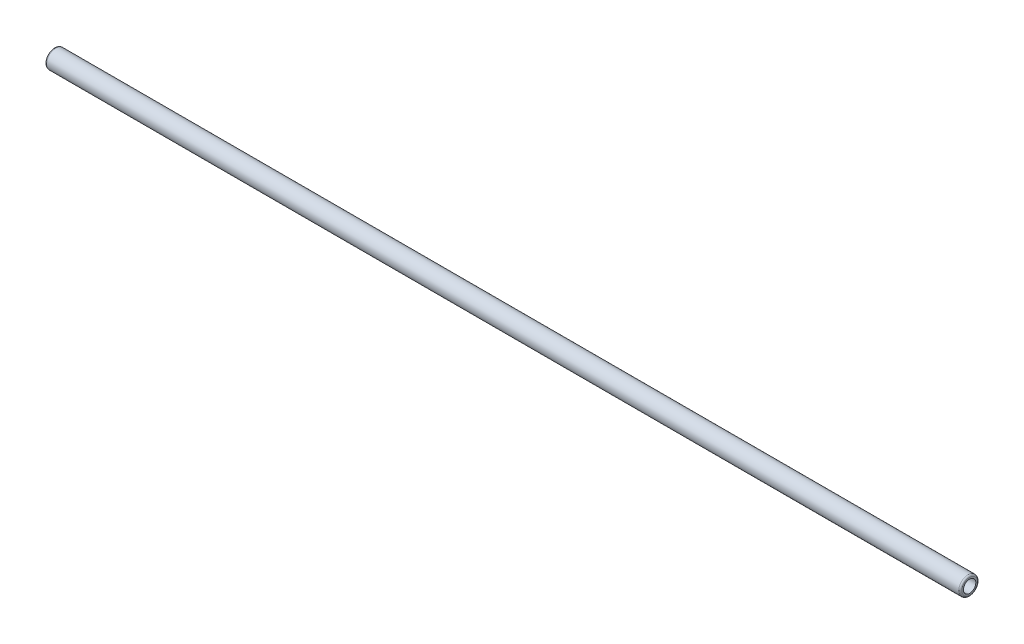
from build123d import *

# Parameters (mm, degrees)
SKETCH_1_R      = 3
SKETCH_1_R_2    = 2
EXTRUDE_1_DEPTH = 148
FILLET_1_R      = 0.5


with BuildPart() as part:
    # Эскиз1 → Бобышка-Вытянуть1 (new, symmetric)
    with BuildSketch(Plane(origin=(0, 0, 0), x_dir=(0, 0, -1), z_dir=(1, 0, 0))):
        Circle(SKETCH_1_R)
        Circle(SKETCH_1_R_2, mode=Mode.SUBTRACT)
    extrude(amount=EXTRUDE_1_DEPTH, both=True)

    # Скругление1
    fillet_1_edges = [part.edges().sort_by_distance(p)[0] for p in [
        (-148, 0, 3),
        (148, 0, 3),
    ]]
    fillet(fillet_1_edges, radius=FILLET_1_R)


solid = part.part
